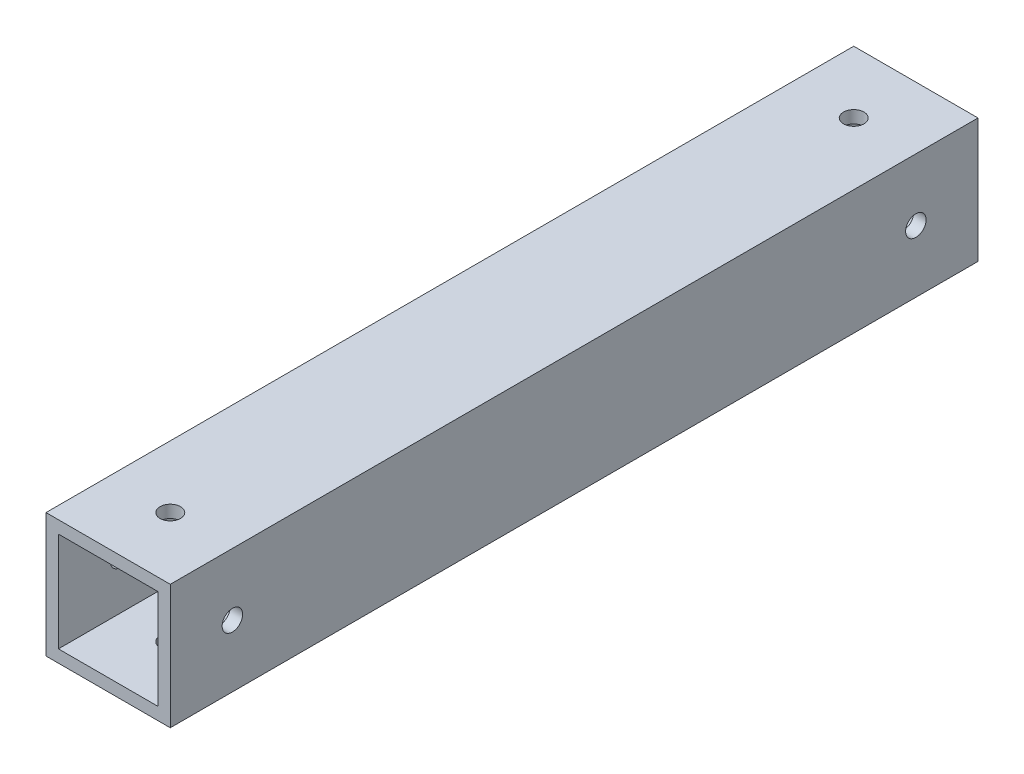
from build123d import *

# Parameters (mm, degrees)
SKETCH_1_W          = 20
SKETCH_1_H          = 20
SKETCH_1_W_2        = 16
SKETCH_1_H_2        = 16
EXTRUDE_1_DEPTH     = 130
SKETCH_2_R          = 1.65
CUT_EXTRUDE_1_DEPTH = 30
SKETCH_3_R          = 1.65
CUT_EXTRUDE_2_DEPTH = 10


with BuildPart() as part:
    # 草图1 → 凸台-拉伸1 (new body)
    with BuildSketch(Plane.XY):
        Rectangle(SKETCH_1_W, SKETCH_1_H)
        Rectangle(SKETCH_1_W_2, SKETCH_1_H_2, mode=Mode.SUBTRACT)
    extrude(amount=EXTRUDE_1_DEPTH)

    # 草图2 → 切除-拉伸1 (cut)
    with BuildSketch(Plane(origin=(0, 10, 0), x_dir=(1, 0, 0), z_dir=(0, 1, 0))):
        with Locations(Location((0, -120, 0), (0, 0, 270))):
            Circle(SKETCH_2_R)
        with Locations(Location((0, -10, 0), (0, 0, 270))):
            Circle(SKETCH_2_R)
    extrude(amount=-CUT_EXTRUDE_1_DEPTH, mode=Mode.SUBTRACT)

    # 草图3 → 切除-拉伸2 (cut, symmetric)
    with BuildSketch(Plane(origin=(0, 0, 0), x_dir=(0, 0, -1), z_dir=(1, 0, 0))):
        with Locations((-120, 0)):
            Circle(SKETCH_3_R)
        with Locations((-10, 0)):
            Circle(SKETCH_3_R)
    extrude(amount=CUT_EXTRUDE_2_DEPTH, both=True, mode=Mode.SUBTRACT)


solid = part.part
